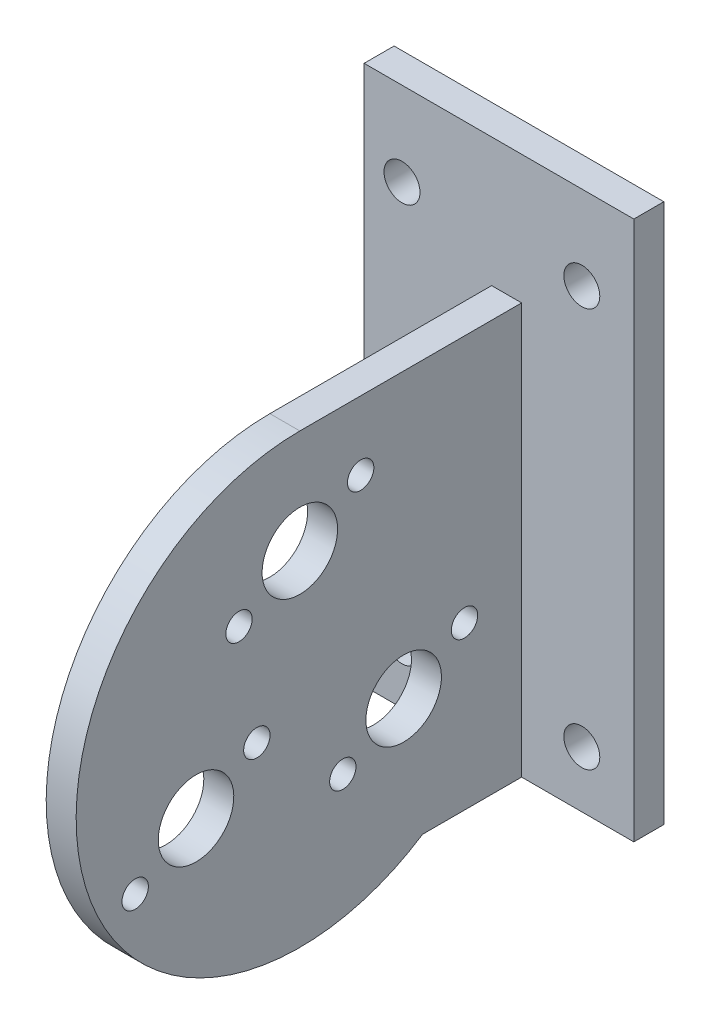
from build123d import *

# Parameters (mm, degrees)
SKETCH1_R           = 23.6982
SKETCH1_R_2         = 1.397
SKETCH1_R_3         = 4.0005
BOSS_EXTRUDE1_DEPTH = 3.175
SKETCH2_W           = 28.575
SKETCH2_H           = 57.15
BOSS_EXTRUDE2_DEPTH = 3.175
BOSS_EXTRUDE3_DEPTH = 3.175
SKETCH5_R           = 1.905
CUT_EXTRUDE2_DEPTH  = 6.35


with BuildPart() as part:
    # Sketch1 → Boss-Extrude1 (new body)
    with BuildSketch(Plane.ZY.offset(-268.497812887)):
        with Locations(Location((-22.229377206, 1.090549523, 0), (0, 0, 270))):
            Circle(SKETCH1_R)
        with Locations(Location((-4.785720318, -8.980550477, 0), (0, 0, 270))):
            Circle(SKETCH1_R_2, mode=Mode.SUBTRACT)
        with Locations(Location((-17.675988838, -1.538350477, 0), (0, 0, 270))):
            Circle(SKETCH1_R_2, mode=Mode.SUBTRACT)
        with Locations(Location((-26.782765574, -8.980550477, 0), (0, 0, 270))):
            Circle(SKETCH1_R_2, mode=Mode.SUBTRACT)
        with Locations(Location((-39.673034094, -1.538350477, 0), (0, 0, 270))):
            Circle(SKETCH1_R_2, mode=Mode.SUBTRACT)
        with Locations(Location((-28.674511466, 17.511649523, 0), (0, 0, 270))):
            Circle(SKETCH1_R_2, mode=Mode.SUBTRACT)
        with Locations(Location((-15.784242946, 10.069449523, 0), (0, 0, 270))):
            Circle(SKETCH1_R_2, mode=Mode.SUBTRACT)
        with Locations(Location((-11.230854578, -5.259450477, 0), (0, 0, 270))):
            Circle(SKETCH1_R_3, mode=Mode.SUBTRACT)
        with Locations(Location((-33.227899834, -5.259450477, 0), (0, 0, 270))):
            Circle(SKETCH1_R_3, mode=Mode.SUBTRACT)
        with Locations(Location((-22.229377206, 13.790549523, 0), (0, 0, 270))):
            Circle(SKETCH1_R_3, mode=Mode.SUBTRACT)
    extrude(amount=BOSS_EXTRUDE1_DEPTH)

    # Sketch2 → Boss-Extrude2 (add)
    with BuildSketch(Plane.XY.offset(-48.899377206)):
        with Locations((266.100312887, 9.853549523)):
            Rectangle(SKETCH2_W, SKETCH2_H)
    extrude(amount=BOSS_EXTRUDE2_DEPTH)

    # Sketch4 → Boss-Extrude3 (add)
    with BuildSketch(Plane(origin=(268.497812887, 0, 0), x_dir=(0, 0, -1), z_dir=(1, 0, 0))):
        with BuildLine():
            Line((45.724377206, -18.721450477), (45.724377206, -2.00616781))
            ThreePointArc((45.724377206, -2.00616781), (42.301350708, -11.507885419), (35.232812877, -18.721450477))
            Line((35.232812877, -18.721450477), (45.724377206, -18.721450477))
        make_face()
        with BuildLine():
            Line((45.724377206, 24.788749523), (22.229377206, 24.788749523))
            ThreePointArc((22.229377206, 24.788749523), (37.853366078, 18.908957279), (45.724377206, 4.187266856))
            Line((45.724377206, 4.187266856), (45.724377206, 24.788749523))
        make_face()
    extrude(amount=-BOSS_EXTRUDE3_DEPTH)

    # Sketch5 → Cut-Extrude2 (cut)
    with BuildSketch(Plane(origin=(0, 0, -48.899377206), x_dir=(-1, 0, 0), z_dir=(0, 0, -1))):
        with Locations((-274.875666904, -12.752450477)):
            Circle(SKETCH5_R)
        with Locations((-274.875666904, 29.538549523)):
            Circle(SKETCH5_R)
        with Locations((-255.825666904, 29.538549523)):
            Circle(SKETCH5_R)
        with Locations((-255.825666904, -12.752450477)):
            Circle(SKETCH5_R)
    extrude(amount=-CUT_EXTRUDE2_DEPTH, mode=Mode.SUBTRACT)


solid = part.part
